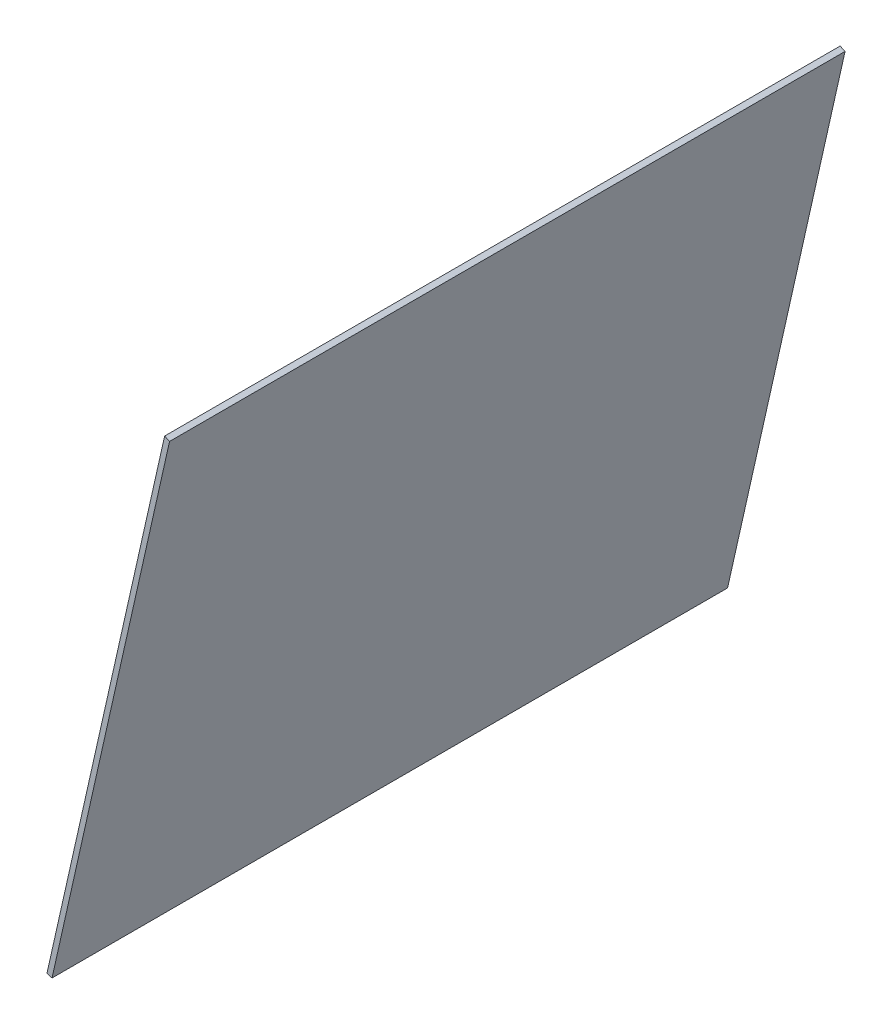
from build123d import *

# Parameters (mm, degrees)
BOSS_EXTRUDE1_DEPTH = 812.8


with BuildPart() as part:
    # Sketch1 → Boss-Extrude1 (new body)
    with BuildSketch(Plane.XY):
        Polygon((-110.603151516, 958.636482434), (-252.220463645, 327.795728405), (-246.083909988, 326.140927418), (-104.697708182, 955.952190009), align=None)
    extrude(amount=BOSS_EXTRUDE1_DEPTH)


solid = part.part
